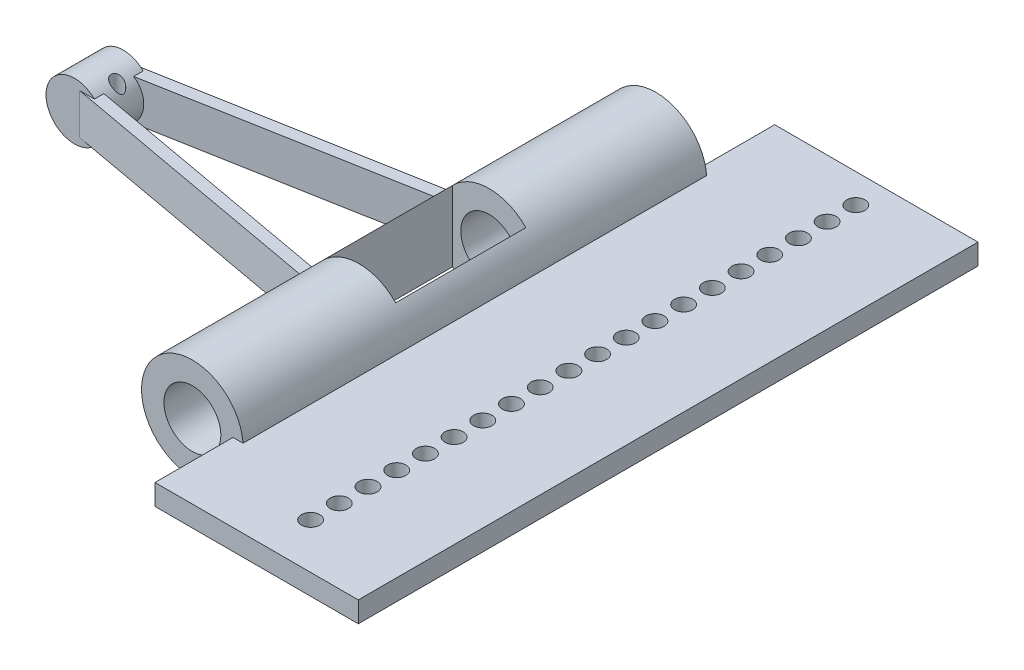
from build123d import *

# Parameters (mm, degrees)
SKETCH1_R           = 12.5
BOSS_EXTRUDE1_DEPTH = 57
SKETCH2_R           = 7
CUT_EXTRUDE1_DEPTH  = 60
SKETCH3_W           = 18
SKETCH3_H           = 32
CUT_EXTRUDE2_DEPTH  = 30
BOSS_EXTRUDE2_START = 2.9
SKETCH4_W           = 50
SKETCH4_H           = 152.4
SKETCH4_R           = 2.25
BOSS_EXTRUDE2_DEPTH = 5.1
BOSS_EXTRUDE3_START = 2
BOSS_EXTRUDE3_DEPTH = 10
SKETCH6_R           = 7
BOSS_EXTRUDE4_DEPTH = 6
SKETCH7_R           = 1.5
CUT_EXTRUDE3_DEPTH  = 14


with BuildPart() as part:
    # Sketch1 → Boss-Extrude1 (new, symmetric)
    with BuildSketch(Plane.XY):
        with Locations((0, 7)):
            Circle(SKETCH1_R)
    extrude(amount=BOSS_EXTRUDE1_DEPTH, both=True)

    # Sketch2 → Cut-Extrude1 (cut, symmetric)
    with BuildSketch(Plane.XY):
        with Locations((0, 7)):
            Circle(SKETCH2_R)
    extrude(amount=CUT_EXTRUDE1_DEPTH, both=True, mode=Mode.SUBTRACT)

    # Sketch3 → Cut-Extrude2 (cut, symmetric)
    with BuildSketch(Plane(origin=(0, 0, 0), x_dir=(1, 0, 0), z_dir=(0, 1, 0))):
        Rectangle(SKETCH3_W, SKETCH3_H)
    extrude(amount=CUT_EXTRUDE2_DEPTH, both=True, mode=Mode.SUBTRACT)

    # Sketch4 → Boss-Extrude2 (add)
    with BuildSketch(Plane(origin=(0, 0, 0), x_dir=(1, 0, 0), z_dir=(0, 1, 0)).offset(BOSS_EXTRUDE2_START)):
        with Locations((35, 0)):
            Rectangle(SKETCH4_W, SKETCH4_H)
        with Locations((37.1, 69.05)):
            Circle(SKETCH4_R, mode=Mode.SUBTRACT)
        with Locations((37.1, 61.9935)):
            Circle(SKETCH4_R, mode=Mode.SUBTRACT)
        with Locations((37.1, 54.937)):
            Circle(SKETCH4_R, mode=Mode.SUBTRACT)
        with Locations((37.1, 47.8805)):
            Circle(SKETCH4_R, mode=Mode.SUBTRACT)
        with Locations((37.1, 40.824)):
            Circle(SKETCH4_R, mode=Mode.SUBTRACT)
        with Locations((37.1, 33.7675)):
            Circle(SKETCH4_R, mode=Mode.SUBTRACT)
        with Locations((37.1, 26.711)):
            Circle(SKETCH4_R, mode=Mode.SUBTRACT)
        with Locations((37.1, 19.6545)):
            Circle(SKETCH4_R, mode=Mode.SUBTRACT)
        with Locations((37.1, 12.598)):
            Circle(SKETCH4_R, mode=Mode.SUBTRACT)
        with Locations((37.1, 5.5415)):
            Circle(SKETCH4_R, mode=Mode.SUBTRACT)
        with Locations((37.1, -1.515)):
            Circle(SKETCH4_R, mode=Mode.SUBTRACT)
        with Locations((37.1, -8.5715)):
            Circle(SKETCH4_R, mode=Mode.SUBTRACT)
        with Locations((37.1, -15.628)):
            Circle(SKETCH4_R, mode=Mode.SUBTRACT)
        with Locations((37.1, -22.6845)):
            Circle(SKETCH4_R, mode=Mode.SUBTRACT)
        with Locations((37.1, -29.741)):
            Circle(SKETCH4_R, mode=Mode.SUBTRACT)
        with Locations((37.1, -36.7975)):
            Circle(SKETCH4_R, mode=Mode.SUBTRACT)
        with Locations((37.1, -43.854)):
            Circle(SKETCH4_R, mode=Mode.SUBTRACT)
        with Locations((37.1, -50.9105)):
            Circle(SKETCH4_R, mode=Mode.SUBTRACT)
        with Locations((37.1, -57.967)):
            Circle(SKETCH4_R, mode=Mode.SUBTRACT)
        with Locations((37.1, -65.0235)):
            Circle(SKETCH4_R, mode=Mode.SUBTRACT)
    extrude(amount=BOSS_EXTRUDE2_DEPTH)

    # Sketch5 → Boss-Extrude3 (add)
    with BuildSketch(Plane(origin=(0, 0, 0), x_dir=(1, 0, 0), z_dir=(0, 1, 0)).offset(BOSS_EXTRUDE3_START)):
        Polygon((-9, 15.68), (-9, 18.68), (-80, 5.77), (-80, 2.77), align=None)
        Polygon((-9, -15.68), (-9, -18.68), (-80, -5.77), (-80, -2.77), align=None)
    extrude(amount=BOSS_EXTRUDE3_DEPTH)

    # Sketch6 → Boss-Extrude4 (add, symmetric)
    with BuildSketch(Plane.XY):
        with Locations((-80, 7)):
            Circle(SKETCH6_R)
    extrude(amount=BOSS_EXTRUDE4_DEPTH, both=True)

    # Sketch7 → Cut-Extrude3 (cut, symmetric)
    with BuildSketch(Plane(origin=(0, 0, 0), x_dir=(1, 0, 0), z_dir=(0, 1, 0))):
        with Locations((-75.5, 0)):
            Circle(SKETCH7_R)
    extrude(amount=CUT_EXTRUDE3_DEPTH, both=True, mode=Mode.SUBTRACT)


solid = part.part
